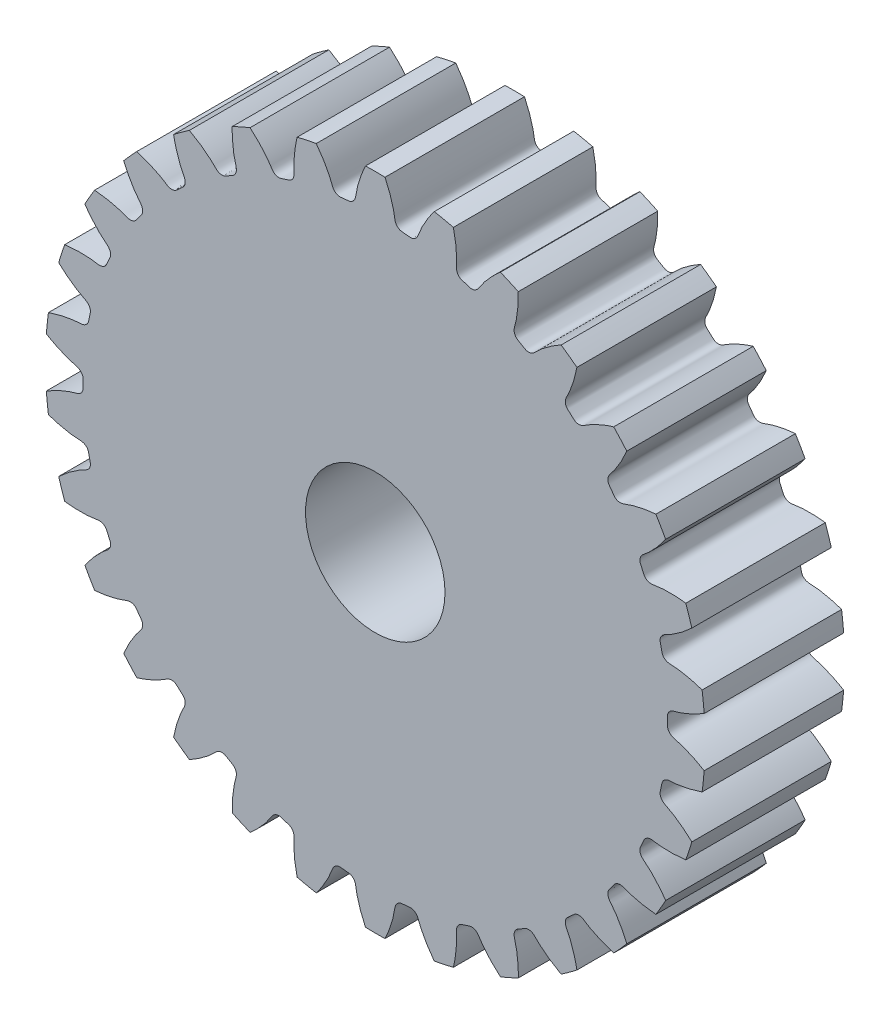
from build123d import *

# Parameters (mm, degrees)
SKETCHREVOLVEGEARTRAX1GEAR_W       = 8
SKETCHREVOLVEGEARTRAX1GEAR_H       = 18.915233333
TOOTHEXTRUDECUTGEARTRAX1GEAR_DEPTH = 4
PATTERNGEARTRAX1GEAR_COUNT         = 30
BOREREVOLVESKETCH_W                = 8
BOREREVOLVESKETCH_H                = 4


with BuildPart() as part:
    # SketchRevolveGeartrax1Gear → Geartrax1Gear (revolve)
    with BuildSketch(Plane(origin=(0, 0, 0), x_dir=(0, 0, -1), z_dir=(1, 0, 0))):
        with Locations((0, 9.457616666)):
            Rectangle(SKETCHREVOLVEGEARTRAX1GEAR_W, SKETCHREVOLVEGEARTRAX1GEAR_H)
    revolve(axis=Axis((0, 0, 0), (0, 0, -1)))

    # SketchToothGeartrax1Gear → ToothExtrudeCutGeartrax1Gear (cut, symmetric)
    with BuildSketch(Plane.XY):
        with BuildLine():
            ThreePointArc((18.907803563, 1.447371606), (18.96312, 0), (18.907803563, -1.447371606))
            add(Edge.make_bspline(
                [(18.907803563, -1.447371606), (18.821729944, -1.394582259), (18.693628012, -1.319062037), (18.523365423, -1.224947319), (18.401778042, -1.160590057), (18.284002268, -1.100959768), (18.170167989, -1.045896119), (18.060400512, -0.995235611), (17.954820506, -0.948811709), (17.853543884, -0.906455086), (17.756681896, -0.867993263), (17.664340541, -0.833252367), (17.576622307, -0.802051623), (17.493619965, -0.774222715), (17.415437411, -0.749544475), (17.342119018, -0.727964151), (17.243138971, -0.700244427), (17.157269651, -0.681743963), (17.086879719, -0.657498528), (17.057655603, -0.646105882), (17.028303173, -0.633101621), (16.998566233, -0.618071882), (16.968171353, -0.600423902), (16.9368694, -0.579331487), (16.90452653, -0.553660084), (16.87130347, -0.521918106), (16.837974658, -0.482314412), (16.806319979, -0.433079821), (16.779594728, -0.373265071), (16.762194296, -0.3061781), (16.754805141, -0.180335922), (16.764613159, 0), (16.754805141, 0.180335922), (16.762194296, 0.3061781), (16.779594728, 0.373265071), (16.806319979, 0.433079821), (16.837974658, 0.482314412), (16.87130347, 0.521918106), (16.90452653, 0.553660084), (16.9368694, 0.579331487), (16.968171353, 0.600423902), (16.998566233, 0.618071882), (17.028303173, 0.633101621), (17.057655603, 0.646105882), (17.086879719, 0.657498528), (17.157269651, 0.681743963), (17.243138971, 0.700244427), (17.342119018, 0.727964151), (17.415437411, 0.749544475), (17.493619965, 0.774222715), (17.576622307, 0.802051623), (17.664340541, 0.833252367), (17.756681896, 0.867993263), (17.853543884, 0.906455086), (17.954820506, 0.948811709), (18.060400512, 0.995235611), (18.170167989, 1.045896119), (18.284002268, 1.100959768), (18.401778042, 1.160590057), (18.523365423, 1.224947319), (18.693628012, 1.319062037), (18.821729944, 1.394582259), (18.907803563, 1.447371606)],
                knots=[0, 0, 0, 0, 0.05409518, 0.079653891, 0.104220017, 0.127793558, 0.150374513, 0.171962883, 0.192558668, 0.212161867, 0.230772481, 0.248390509, 0.265015952, 0.280648809, 0.295289081, 0.308936768, 0.321591869, 0.350362627, 0.355881722, 0.361459867, 0.367162875, 0.373074602, 0.379301997, 0.385980641, 0.393279172, 0.401398522, 0.410557156, 0.420947748, 0.432651488, 0.445522413, 0.457824444, 0.5, 0.542175556, 0.554477587, 0.567348512, 0.579052252, 0.589442844, 0.598601478, 0.606720828, 0.614019359, 0.620698003, 0.626925398, 0.632837125, 0.638540133, 0.644118278, 0.649637373, 0.678408131, 0.691063232, 0.704710919, 0.719351191, 0.734984048, 0.751609491, 0.769227519, 0.787838133, 0.807441332, 0.828037117, 0.849625487, 0.872206442, 0.895779983, 0.920346109, 0.94590482, 1, 1, 1, 1], degree=3))
        make_face()
    toothextrudecutgeartrax1gear = extrude(amount=TOOTHEXTRUDECUTGEARTRAX1GEAR_DEPTH, both=True, mode=Mode.SUBTRACT)

    # PatternGeartrax1Gear: ToothExtrudeCutGeartrax1Gear ×30 about axis
    patterngeartrax1gear_axis = Axis((0, 0, 55), (0, 0, -1))
    for i in range(1, PATTERNGEARTRAX1GEAR_COUNT):
        add(toothextrudecutgeartrax1gear.rotate(patterngeartrax1gear_axis, i * 360 / PATTERNGEARTRAX1GEAR_COUNT), mode=Mode.SUBTRACT)

    # BoreRevolveSketch → BoreRevolveCut (revolve, cut)
    with BuildSketch(Plane(origin=(0, 0, 0), x_dir=(0, 0, -1), z_dir=(1, 0, 0))):
        with Locations((0, 2)):
            Rectangle(BOREREVOLVESKETCH_W, BOREREVOLVESKETCH_H)
    revolve(axis=Axis((0, 0, 0), (0, 0, -1)), mode=Mode.SUBTRACT)


solid = part.part
